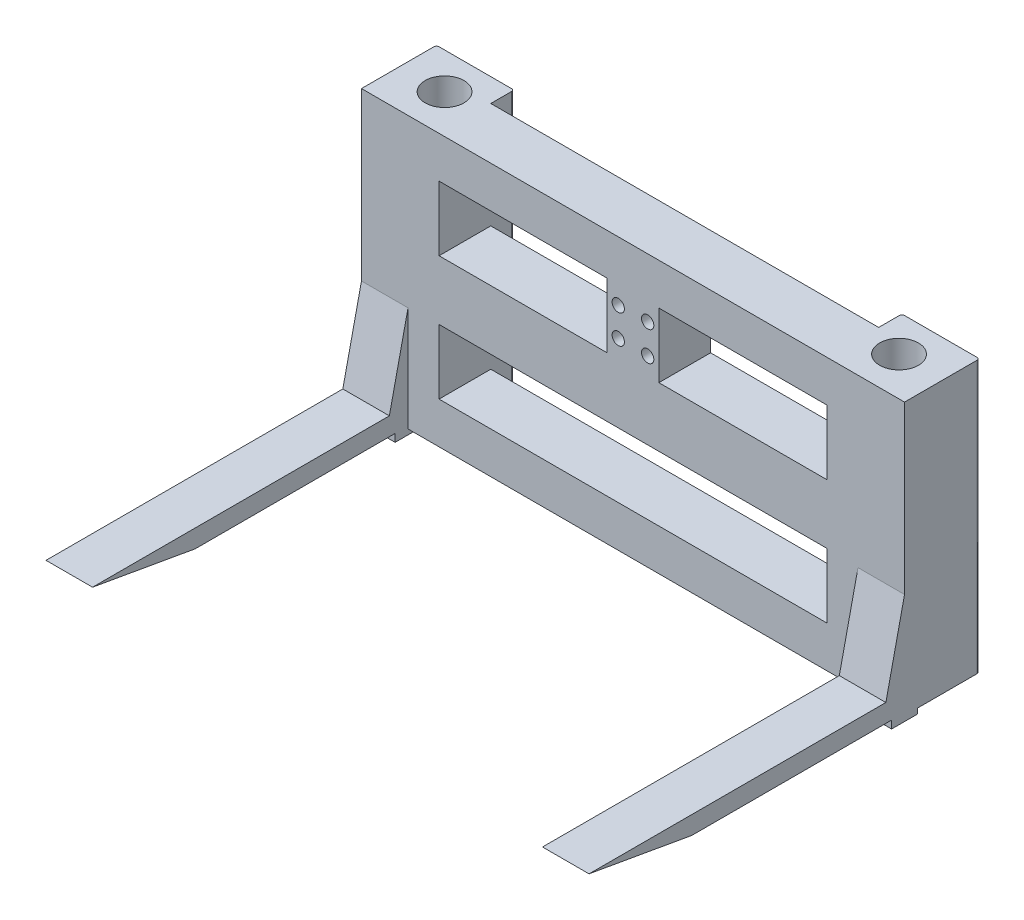
from build123d import *

# Parameters (mm, degrees)
SKETCH1_W               = 210
SKETCH1_H               = 105
BOSS_EXTRUDE1_DEPTH     = 20
SKETCH3_W               = 18
SKETCH3_H               = 18
CUT_EXTRUDE1_DEPTH      = 5
SKETCH6_W               = 18
SKETCH6_H               = 20
BOSS_EXTRUDE2_DEPTH     = 10
SKETCH7_W               = 18
SKETCH7_H               = 7
CUT_EXTRUDE2_DEPTH      = 3
SKETCH8_W               = 18
SKETCH8_H               = 7
BOSS_EXTRUDE3_DEPTH     = 120
CUT_EXTRUDE4_DEPTH      = 261.74205403
CUT_EXTRUDE4_DEPTH_BACK = 261.74205403
SKETCH12_W              = 150
SKETCH12_H              = 25
CUT_EXTRUDE5_DEPTH      = 176.159501213
SKETCH15_W              = 30
SKETCH15_H              = 9
BOSS_EXTRUDE4_DEPTH     = 105
SKETCH16_R              = 7.5
CUT_EXTRUDE11_DEPTH     = 105
SKETCH20_W              = 20
SKETCH20_H              = 25
BOSS_EXTRUDE5_DEPTH     = 20
SKETCH21_R              = 2.375
CUT_EXTRUDE9_DEPTH      = 20
FILLET1_R               = 1
BOSS_EXTRUDE6_DEPTH     = 18
BOSS_EXTRUDE7_DEPTH     = 18
SCALE1_SCALE            = 0.4


with BuildPart() as part:
    # Sketch1 → Boss-Extrude1 (new body)
    with BuildSketch(Plane.XY):
        with Locations((4.88372093, -6.511627907)):
            Rectangle(SKETCH1_W, SKETCH1_H)
    extrude(amount=BOSS_EXTRUDE1_DEPTH)

    # Sketch3 → Cut-Extrude1 (cut)
    with BuildSketch(Plane.XY.offset(20)):
        with Locations((-91.11627907, -50.011627907)):
            Rectangle(SKETCH3_W, SKETCH3_H)
        with Locations((100.88372093, -50.011627907)):
            Rectangle(SKETCH3_W, SKETCH3_H)
    extrude(amount=-CUT_EXTRUDE1_DEPTH, mode=Mode.SUBTRACT)

    # Sketch6 → Boss-Extrude2 (add)
    with BuildSketch(Plane.XY.offset(15)):
        with Locations((-91.11627907, -51.011627907)):
            Rectangle(SKETCH6_W, SKETCH6_H)
        with Locations((100.88372093, -51.011627907)):
            Rectangle(SKETCH6_W, SKETCH6_H)
    extrude(amount=BOSS_EXTRUDE2_DEPTH)

    # Sketch7 → Cut-Extrude2 (cut)
    with BuildSketch(Plane.XY.offset(25)):
        with Locations((-91.11627907, -54.511627907)):
            Rectangle(SKETCH7_W, SKETCH7_H)
        with Locations((100.88372093, -54.511627907)):
            Rectangle(SKETCH7_W, SKETCH7_H)
    extrude(amount=-CUT_EXTRUDE2_DEPTH, mode=Mode.SUBTRACT)

    # Sketch8 → Boss-Extrude3 (add)
    with BuildSketch(Plane.XY.offset(22)):
        with Locations((-91.11627907, -54.511627907)):
            Rectangle(SKETCH8_W, SKETCH8_H)
        with Locations((100.88372093, -54.511627907)):
            Rectangle(SKETCH8_W, SKETCH8_H)
    extrude(amount=BOSS_EXTRUDE3_DEPTH)

    # Sketch9 → Cut-Extrude4 (cut, two sides: drawn at the far end of the back side and taken through both)
    with BuildSketch(Plane(origin=(109.88372093, 0, 0), x_dir=(0, 0, -1), z_dir=(1, 0, 0)).offset(-CUT_EXTRUDE4_DEPTH_BACK)):
        Polygon((-490.55895682, 10.448720548), (-142, -51.011627907), (-102.301027263, -58.011627907), (246.257929557, -119.471976362), (123.337232647, -816.589890001), (-613.479653729, -686.669193091), align=None)
    extrude(amount=CUT_EXTRUDE4_DEPTH + CUT_EXTRUDE4_DEPTH_BACK, mode=Mode.SUBTRACT)

    # Sketch12 → Cut-Extrude5 (cut, through all)
    with BuildSketch(Plane.XY.offset(20)):
        with Locations((4.88372093, 17.488372093)):
            Rectangle(SKETCH12_W, SKETCH12_H)
        with Locations((4.88372093, -30.511627907)):
            Rectangle(SKETCH12_W, SKETCH12_H)
    extrude(amount=-CUT_EXTRUDE5_DEPTH, mode=Mode.SUBTRACT)

    # Sketch15 → Boss-Extrude4 (add)
    with BuildSketch(Plane(origin=(0, 45.988372093, 0), x_dir=(1, 0, 0), z_dir=(0, 1, 0))):
        with Locations((-85.11627907, 4.5)):
            Rectangle(SKETCH15_W, SKETCH15_H)
        with Locations((94.88372093, 4.5)):
            Rectangle(SKETCH15_W, SKETCH15_H)
    extrude(amount=-BOSS_EXTRUDE4_DEPTH)

    # Sketch16 → Cut-Extrude11 (cut)
    with BuildSketch(Plane(origin=(0, 45.988372093, 0), x_dir=(1, 0, 0), z_dir=(0, 1, 0))):
        with Locations(Location((-82.99127907, -5, 0), (0, 0, 270))):
            Circle(SKETCH16_R)
        with Locations(Location((92.75872093, -5, 0), (0, 0, 270))):
            Circle(SKETCH16_R)
    extrude(amount=-CUT_EXTRUDE11_DEPTH, mode=Mode.SUBTRACT)

    # Sketch20 → Boss-Extrude5 (add)
    with BuildSketch(Plane.XY.offset(20)):
        with Locations((4.88372093, 17.488372093)):
            Rectangle(SKETCH20_W, SKETCH20_H)
    extrude(amount=-BOSS_EXTRUDE5_DEPTH)

    # Sketch21 → Cut-Extrude9 (cut)
    with BuildSketch(Plane.XY.offset(20)):
        with Locations((-0.81877907, 11.938372093)):
            Circle(SKETCH21_R)
        with Locations((10.55622093, 11.788372093)):
            Circle(SKETCH21_R)
        with Locations(Location((10.55622093, 23.188372093, 0), (0, 0, 180))):
            Circle(SKETCH21_R)
        with Locations(Location((-0.81877907, 23.038372093, 0), (0, 0, 180))):
            Circle(SKETCH21_R)
    extrude(amount=-CUT_EXTRUDE9_DEPTH, mode=Mode.SUBTRACT)

    # Fillet1
    fillet1_edges = [part.edges().sort_by_distance(p)[0] for p in [
        (-100.11627907, -6.511627907, -9),
        (-70.11627907, -6.511627907, -9),
        (109.88372093, -6.511627907, -9),
        (79.88372093, -6.511627907, -9),
    ]]
    fillet(fillet1_edges, radius=FILLET1_R)

    # Sketch23 → Boss-Extrude6 (add)
    with BuildSketch(Plane.ZY.offset(100.11627907)):
        Polygon((20, -18.461238028), (27.217256565, -51.011627907), (20, -51.011627907), align=None)
    extrude(amount=-BOSS_EXTRUDE6_DEPTH)

    # Sketch25 → Boss-Extrude7 (add)
    with BuildSketch(Plane(origin=(109.88372093, 0, 0), x_dir=(0, 0, -1), z_dir=(1, 0, 0))):
        Polygon((-20, -18.461238028), (-27.217256565, -51.011627907), (-20, -51.011627907), align=None)
    extrude(amount=-BOSS_EXTRUDE7_DEPTH)


with BuildPart() as part_1:
    # Scale1: scaled about (4.883781695, -9.980592238, 12.902521202)
    add(part.part.scale(SCALE1_SCALE).moved(Location((2.930269017, -5.988355343, 7.741512721))))


solid = part_1.part
